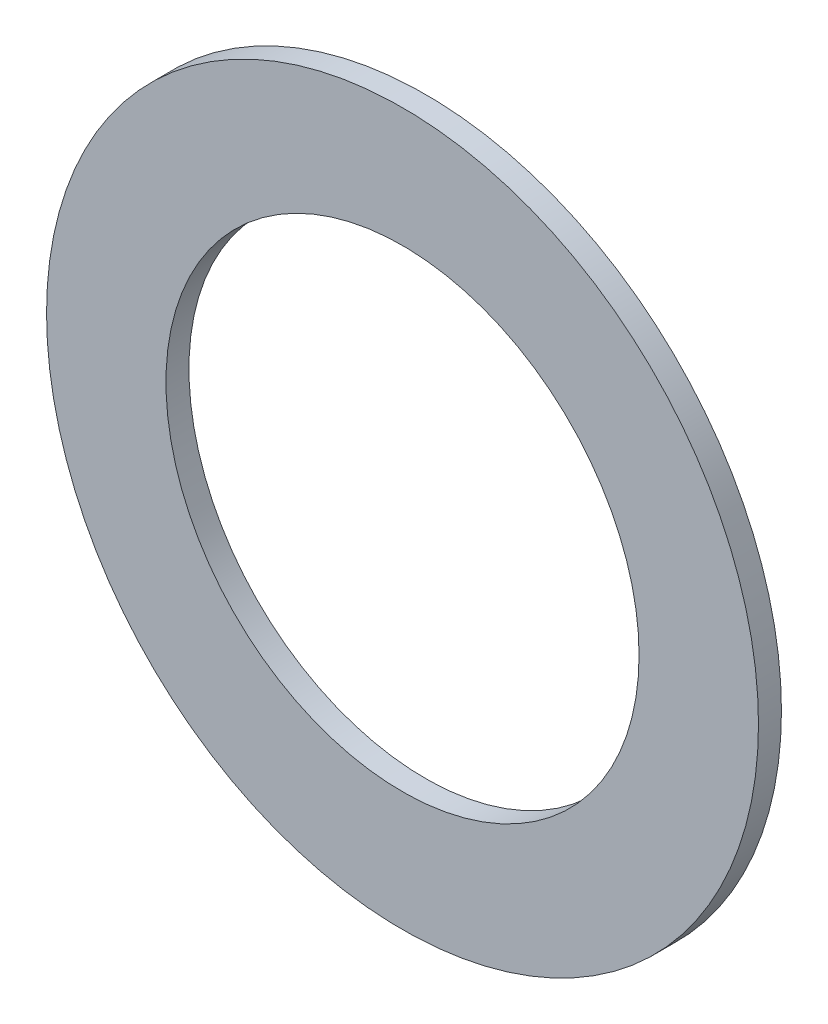
from build123d import *

# Parameters (mm, degrees)
SKETCH1_W = 0.254
SKETCH1_H = 1.3208


with BuildPart() as part:
    # Sketch1 → Revolve1 (revolve)
    with BuildSketch(Plane(origin=(0, 0, 0), x_dir=(0, 0, -1), z_dir=(1, 0, 0)), mode=Mode.PRIVATE) as revolve1_sk:
        with Locations((0.127, 3.2766)):
            Rectangle(SKETCH1_W, SKETCH1_H)
    revolve(revolve1_sk.sketch.rotate(Axis((0, 0, 5.220594576), (0, 0, -1)), 90), axis=Axis((0, 0, 5.220594576), (0, 0, -1)))


solid = part.part
